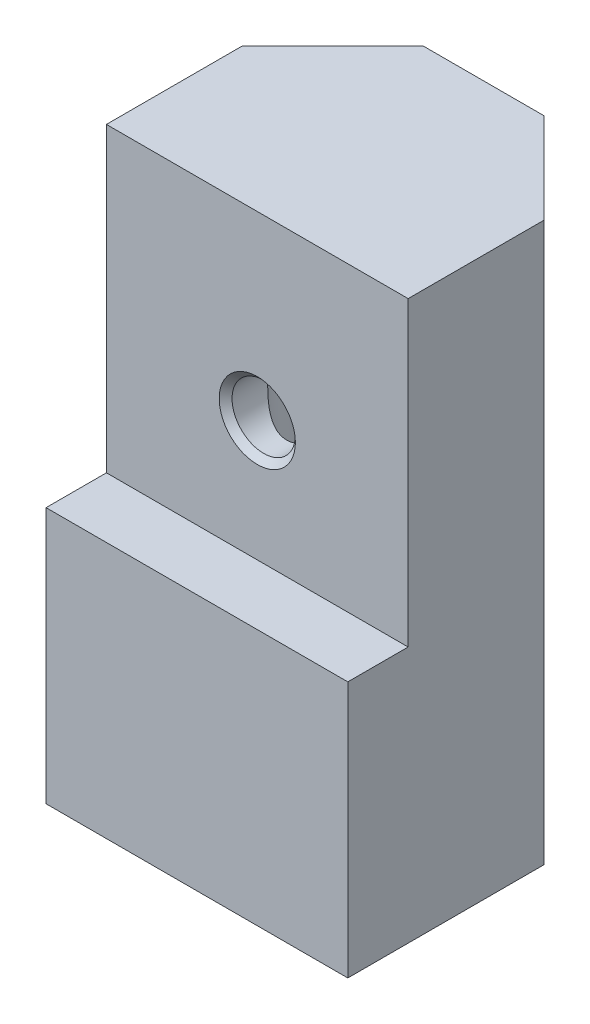
from build123d import *

# Parameters (mm, degrees)
SKETCH1_W                   = 20
SKETCH1_H                   = 17
BOSS_EXTRUDE1_DEPTH         = 4
SKETCH2_W                   = 20
SKETCH2_H                   = 37
BOSS_EXTRUDE2_DEPTH         = 15
M5_TAPPED_HOLE1_D           = 4.2
M5_TAPPED_HOLE1_DEPTH       = 9.8
M5_TAPPED_HOLE1_CSINK_D     = 5.05
M5_TAPPED_HOLE1_CSINK_ANGLE = 90
M5_TAPPED_HOLE1_TIP         = 1.2618073
SKETCH5_R                   = 3.05
CUT_EXTRUDE1_DEPTH          = 25
CHAMFER1_SIZE               = 6


with BuildPart() as part:
    # Sketch1 → Boss-Extrude1 (new body)
    with BuildSketch(Plane.XY):
        Rectangle(SKETCH1_W, SKETCH1_H)
    extrude(amount=BOSS_EXTRUDE1_DEPTH)

    # Sketch2 → Boss-Extrude2 (add)
    with BuildSketch(Plane(origin=(0, 0, 0), x_dir=(-1, 0, 0), z_dir=(0, 0, -1))):
        with Locations((0, 10)):
            Rectangle(SKETCH2_W, SKETCH2_H)
    extrude(amount=BOSS_EXTRUDE2_DEPTH)

    # M5 Tapped Hole1
    with Locations(Plane(origin=(0, 16.5, 0), x_dir=(1, 0, 0), z_dir=(0, 0, 1))):
        with Locations((0, 0)):
            CounterSinkHole(M5_TAPPED_HOLE1_D / 2, M5_TAPPED_HOLE1_CSINK_D / 2, depth=M5_TAPPED_HOLE1_DEPTH, counter_sink_angle=M5_TAPPED_HOLE1_CSINK_ANGLE)
            with Locations((0, 0, -(M5_TAPPED_HOLE1_DEPTH + M5_TAPPED_HOLE1_TIP / 2))):  # 118° drill point
                Cone(0, M5_TAPPED_HOLE1_D / 2, M5_TAPPED_HOLE1_TIP, mode=Mode.SUBTRACT)

    # Sketch5 → Cut-Extrude1 (cut)
    with BuildSketch(Plane.XZ.offset(8.5)):
        with Locations(Location((0, -5, 0), (0, 0, 270))):
            Circle(SKETCH5_R)
    extrude(amount=-CUT_EXTRUDE1_DEPTH, mode=Mode.SUBTRACT)

    # Chamfer1
    chamfer1_edges = [part.edges().sort_by_distance(p)[0] for p in [
        (10, 10, -15),
        (-10, 10, -15),
    ]]
    chamfer(chamfer1_edges, length=CHAMFER1_SIZE)


solid = part.part
